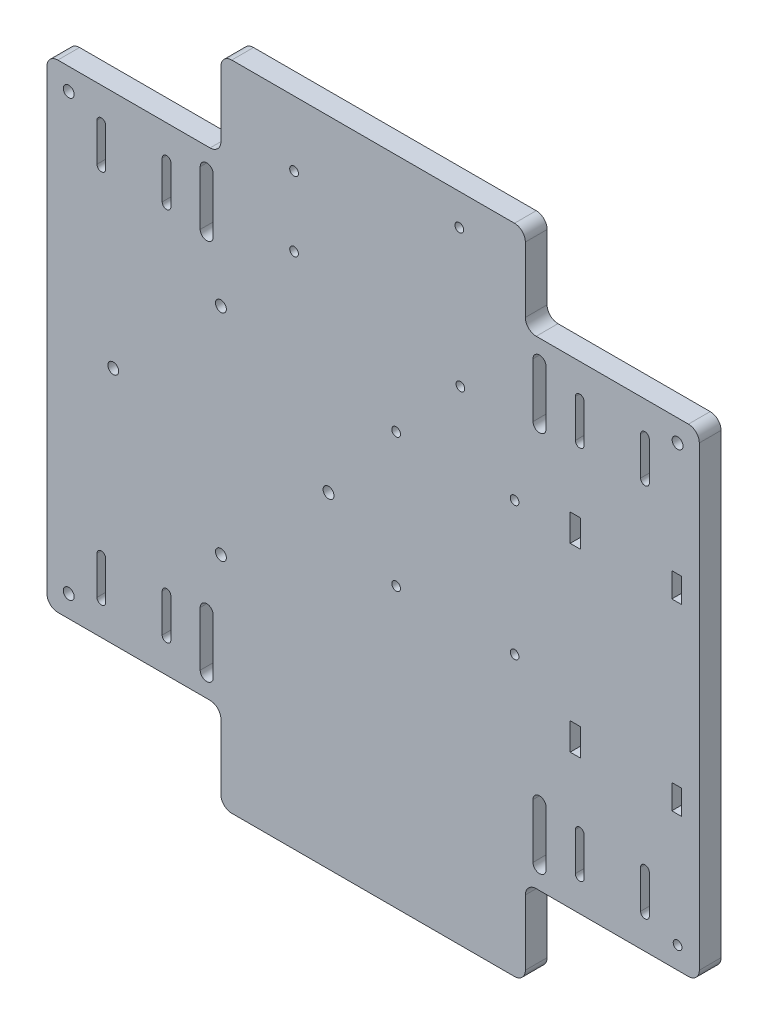
from build123d import *

# Parameters (mm, degrees)
SKETCH_1_R      = 2.5
SKETCH_1_R_2    = 2
SKETCH_1_W      = 4.718060626
SKETCH_1_H      = 12.511006694
SKETCH_1_W_2    = 4.554527511
SKETCH_1_H_2    = 11.281053154
SKETCH_1_H_3    = 12.511006695
SKETCH_1_H_4    = 11.281053155
EXTRUDE_1_DEPTH = 10


with BuildPart() as part:
    # 草图1 → 凸台-拉伸1 (new body)
    with BuildSketch(Plane.XY):
        with BuildLine():
            ThreePointArc((79.970680431, 2.987579423), (81.435146525, -0.547954483), (84.970680431, -2.012420577))
            Line((84.970680431, -2.012420577), (214.970680431, -2.012420577))
            ThreePointArc((214.970680431, -2.012420577), (218.506214337, -0.547954483), (219.970680431, 2.987579423))
            Line((219.970680431, 2.987579423), (219.970680431, 32.987579423))
            ThreePointArc((219.970680431, 32.987579423), (221.435146525, 36.523113329), (224.970680431, 37.987579423))
            Line((224.970680431, 37.987579423), (294.970680431, 37.987579423))
            ThreePointArc((294.970680431, 37.987579423), (298.506214337, 39.452045517), (299.970680431, 42.987579423))
            Line((299.970680431, 42.987579423), (299.970680431, 252.987579423))
            ThreePointArc((299.970680431, 252.987579423), (298.506214337, 256.523113329), (294.970680431, 257.987579423))
            Line((294.970680431, 257.987579423), (224.970680431, 257.987579423))
            ThreePointArc((224.970680431, 257.987579423), (221.435146525, 259.452045517), (219.970680431, 262.987579423))
            Line((219.970680431, 262.987579423), (219.970680431, 292.987579423))
            ThreePointArc((219.970680431, 292.987579423), (218.506214337, 296.523113329), (214.970680431, 297.987579423))
            Line((214.970680431, 297.987579423), (84.970680431, 297.987579423))
            ThreePointArc((84.970680431, 297.987579423), (81.435146525, 296.523113329), (79.970680431, 292.987579423))
            Line((79.970680431, 292.987579423), (79.970680431, 262.987579423))
            ThreePointArc((79.970680431, 262.987579423), (78.506214337, 259.452045517), (74.970680431, 257.987579423))
            Line((74.970680431, 257.987579423), (4.970680431, 257.987579423))
            ThreePointArc((4.970680431, 257.987579423), (1.435146525, 256.523113329), (-0.029319569, 252.987579423))
            Line((-0.029319569, 252.987579423), (-0.029319569, 42.987579423))
            ThreePointArc((-0.029319569, 42.987579423), (1.435146525, 39.452045517), (4.970680431, 37.987579423))
            Line((4.970680431, 37.987579423), (74.970680431, 37.987579423))
            ThreePointArc((74.970680431, 37.987579423), (78.506214337, 36.523113329), (79.970680431, 32.987579423))
            Line((79.970680431, 32.987579423), (79.970680431, 2.987579423))
        make_face()
        with Locations((9.970680431, 47.987579423)):
            Circle(SKETCH_1_R, mode=Mode.SUBTRACT)
        with BuildLine():
            ThreePointArc((22.970680431, 70.487579423), (24.970680431, 72.487579423), (26.970680431, 70.487579423))
            Line((26.970680431, 70.487579423), (26.970680431, 52.987579423))
            ThreePointArc((26.970680431, 52.987579423), (24.970680431, 50.987579423), (22.970680431, 52.987579423))
            Line((22.970680431, 52.987579423), (22.970680431, 70.487579423))
        make_face(mode=Mode.SUBTRACT)
        with BuildLine():
            ThreePointArc((52.970680431, 70.487579423), (54.970680431, 72.487579423), (56.970680431, 70.487579423))
            Line((56.970680431, 70.487579423), (56.970680431, 52.987579423))
            ThreePointArc((56.970680431, 52.987579423), (54.970680431, 50.987579423), (52.970680431, 52.987579423))
            Line((52.970680431, 52.987579423), (52.970680431, 70.487579423))
        make_face(mode=Mode.SUBTRACT)
        with BuildLine():
            ThreePointArc((76.446824756, 47.714083435), (73.446824756, 44.714083435), (70.446824756, 47.714083435))
            Line((70.446824756, 47.714083435), (70.446824756, 72.714083435))
            ThreePointArc((70.446824756, 72.714083435), (73.446824756, 75.714083435), (76.446824756, 72.714083435))
            Line((76.446824756, 72.714083435), (76.446824756, 47.714083435))
        make_face(mode=Mode.SUBTRACT)
        with Locations((30.470680431, 147.987579423)):
            Circle(SKETCH_1_R, mode=Mode.SUBTRACT)
        with Locations((79.970680431, 98.487579423)):
            Circle(SKETCH_1_R, mode=Mode.SUBTRACT)
        with Locations((129.470680431, 147.987579423)):
            Circle(SKETCH_1_R, mode=Mode.SUBTRACT)
        with BuildLine():
            Line((229.494536105, 72.714083435), (229.494536105, 47.714083435))
            ThreePointArc((229.494536105, 47.714083435), (226.494536105, 44.714083435), (223.494536105, 47.714083435))
            Line((223.494536105, 47.714083435), (223.494536105, 72.714083435))
            ThreePointArc((223.494536105, 72.714083435), (226.494536105, 75.714083435), (229.494536105, 72.714083435))
        make_face(mode=Mode.SUBTRACT)
        with BuildLine():
            ThreePointArc((242.970680431, 70.487579423), (244.970680431, 72.487579423), (246.970680431, 70.487579423))
            Line((246.970680431, 70.487579423), (246.970680431, 52.987579423))
            ThreePointArc((246.970680431, 52.987579423), (244.970680431, 50.987579423), (242.970680431, 52.987579423))
            Line((242.970680431, 52.987579423), (242.970680431, 70.487579423))
        make_face(mode=Mode.SUBTRACT)
        with Locations((289.970680431, 47.987579423)):
            Circle(SKETCH_1_R_2, mode=Mode.SUBTRACT)
        with BuildLine():
            ThreePointArc((276.970680431, 52.987579423), (274.970680431, 50.987579423), (272.970680431, 52.987579423))
            Line((272.970680431, 52.987579423), (272.970680431, 70.487579423))
            ThreePointArc((272.970680431, 70.487579423), (274.970680431, 72.487579423), (276.970680431, 70.487579423))
            Line((276.970680431, 70.487579423), (276.970680431, 52.987579423))
        make_face(mode=Mode.SUBTRACT)
        with Locations((160.553347356, 126.301390813)):
            Circle(SKETCH_1_R_2, mode=Mode.SUBTRACT)
        with Locations((215.033347356, 126.301390813)):
            Circle(SKETCH_1_R_2, mode=Mode.SUBTRACT)
        with Locations((242.957198236, 106.410275276)):
            Rectangle(SKETCH_1_W, SKETCH_1_H, mode=Mode.SUBTRACT)
        with Locations((289.593492305, 105.795298506)):
            Rectangle(SKETCH_1_W_2, SKETCH_1_H_2, mode=Mode.SUBTRACT)
        with Locations((79.970680431, 197.487579423)):
            Circle(SKETCH_1_R, mode=Mode.SUBTRACT)
        with BuildLine():
            Line((26.970680431, 242.987579423), (26.970680431, 225.487579423))
            ThreePointArc((26.970680431, 225.487579423), (24.970680431, 223.487579423), (22.970680431, 225.487579423))
            Line((22.970680431, 225.487579423), (22.970680431, 242.987579423))
            ThreePointArc((22.970680431, 242.987579423), (24.970680431, 244.987579423), (26.970680431, 242.987579423))
        make_face(mode=Mode.SUBTRACT)
        with Locations((9.970680431, 247.987579423)):
            Circle(SKETCH_1_R, mode=Mode.SUBTRACT)
        with BuildLine():
            Line((56.970680431, 242.987579423), (56.970680431, 225.487579423))
            ThreePointArc((56.970680431, 225.487579423), (54.970680431, 223.487579423), (52.970680431, 225.487579423))
            Line((52.970680431, 225.487579423), (52.970680431, 242.987579423))
            ThreePointArc((52.970680431, 242.987579423), (54.970680431, 244.987579423), (56.970680431, 242.987579423))
        make_face(mode=Mode.SUBTRACT)
        with BuildLine():
            Line((70.446824756, 223.261075411), (70.446824756, 248.261075411))
            ThreePointArc((70.446824756, 248.261075411), (73.446824756, 251.261075411), (76.446824756, 248.261075411))
            Line((76.446824756, 248.261075411), (76.446824756, 223.261075411))
            ThreePointArc((76.446824756, 223.261075411), (73.446824756, 220.261075411), (70.446824756, 223.261075411))
        make_face(mode=Mode.SUBTRACT)
        with Locations((113.606281629, 236.082638095)):
            Circle(SKETCH_1_R_2, mode=Mode.SUBTRACT)
        with Locations((113.606281629, 268.082638095)):
            Circle(SKETCH_1_R_2, mode=Mode.SUBTRACT)
        with Locations((160.553347356, 187.721390813)):
            Circle(SKETCH_1_R_2, mode=Mode.SUBTRACT)
        with Locations((215.033347356, 187.721390813)):
            Circle(SKETCH_1_R_2, mode=Mode.SUBTRACT)
        with Locations((190.106281629, 220.582638095)):
            Circle(SKETCH_1_R_2, mode=Mode.SUBTRACT)
        with Locations((242.957198236, 189.56488357)):
            Rectangle(SKETCH_1_W, SKETCH_1_H_3, mode=Mode.SUBTRACT)
        with Locations((289.593492305, 190.17986034)):
            Rectangle(SKETCH_1_W_2, SKETCH_1_H_4, mode=Mode.SUBTRACT)
        with Locations((189.606281629, 283.582638095)):
            Circle(SKETCH_1_R_2, mode=Mode.SUBTRACT)
        with BuildLine():
            ThreePointArc((223.494536105, 248.261075411), (226.494536105, 251.261075411), (229.494536105, 248.261075411))
            Line((229.494536105, 248.261075411), (229.494536105, 223.261075411))
            ThreePointArc((229.494536105, 223.261075411), (226.494536105, 220.261075411), (223.494536105, 223.261075411))
            Line((223.494536105, 223.261075411), (223.494536105, 248.261075411))
        make_face(mode=Mode.SUBTRACT)
        with BuildLine():
            Line((246.970680431, 242.987579423), (246.970680431, 225.487579423))
            ThreePointArc((246.970680431, 225.487579423), (244.970680431, 223.487579423), (242.970680431, 225.487579423))
            Line((242.970680431, 225.487579423), (242.970680431, 242.987579423))
            ThreePointArc((242.970680431, 242.987579423), (244.970680431, 244.987579423), (246.970680431, 242.987579423))
        make_face(mode=Mode.SUBTRACT)
        with BuildLine():
            Line((272.970680431, 225.487579423), (272.970680431, 242.987579423))
            ThreePointArc((272.970680431, 242.987579423), (274.970680431, 244.987579423), (276.970680431, 242.987579423))
            Line((276.970680431, 242.987579423), (276.970680431, 225.487579423))
            ThreePointArc((276.970680431, 225.487579423), (274.970680431, 223.487579423), (272.970680431, 225.487579423))
        make_face(mode=Mode.SUBTRACT)
        with Locations((289.970680431, 247.987579423)):
            Circle(SKETCH_1_R, mode=Mode.SUBTRACT)
    extrude(amount=EXTRUDE_1_DEPTH)


solid = part.part
